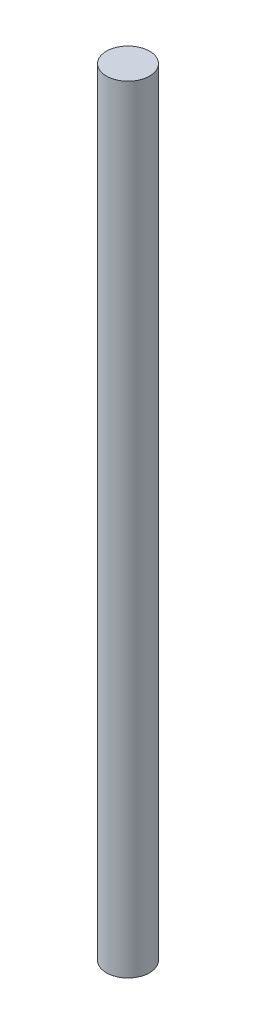
from build123d import *

# Parameters (mm, degrees)
SKETCH1_R           = 1
BOSS_EXTRUDE1_DEPTH = 36


with BuildPart() as part:
    # Sketch1 → Boss-Extrude1 (new body)
    with BuildSketch(Plane(origin=(0, 0, 0), x_dir=(1, 0, 0), z_dir=(0, 1, 0))):
        with Locations(Location((0, 0, 0), (0, 0, 270))):
            Circle(SKETCH1_R)
    extrude(amount=BOSS_EXTRUDE1_DEPTH)


solid = part.part
